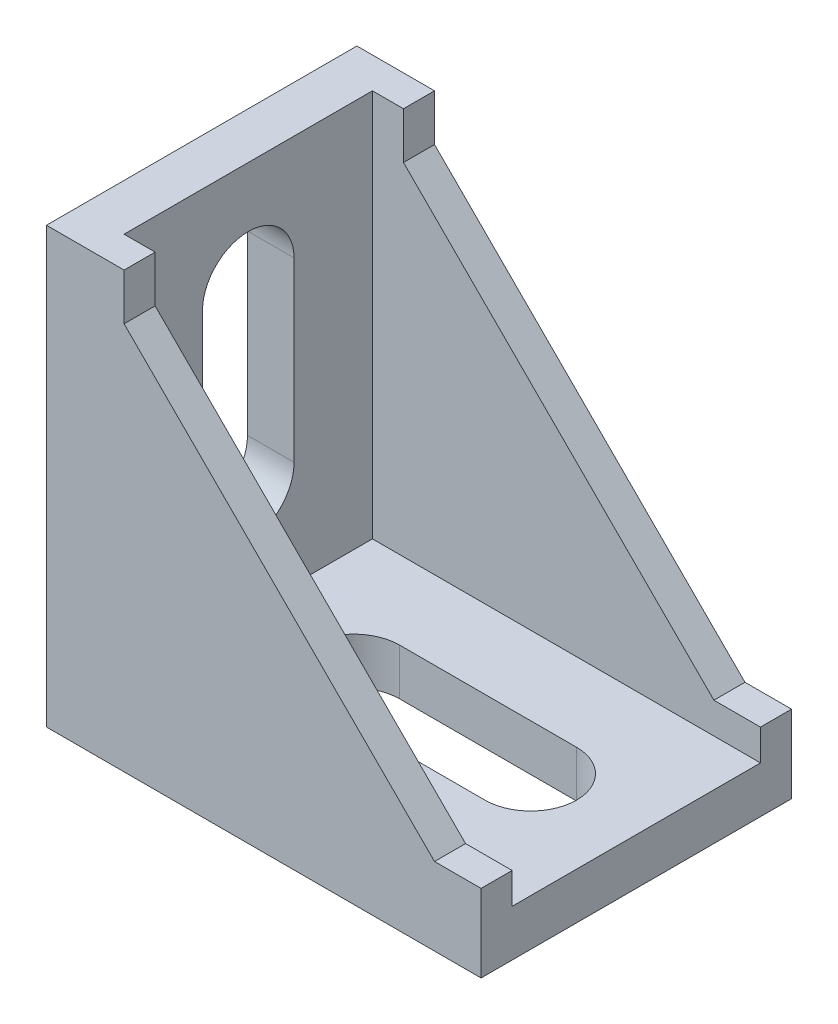
from build123d import *

# Parameters (mm, degrees)
BOSS_EXTRUDE1_DEPTH = 20
CUT_EXTRUDE1_DEPTH  = 10
CUT_EXTRUDE2_DEPTH  = 10
BOSS_EXTRUDE2_DEPTH = 2


with BuildPart() as part:
    # Sketch2 → Boss-Extrude1 (new body)
    with BuildSketch(Plane.XY):
        Polygon((0, 0), (0, 28), (3, 28), (3, 3), (28, 3), (28, 0), align=None)
    extrude(amount=-BOSS_EXTRUDE1_DEPTH)

    # Sketch4 → Cut-Extrude1 (cut)
    with BuildSketch(Plane(origin=(0, 3, 0), x_dir=(1, 0, 0), z_dir=(0, 1, 0))):
        with BuildLine():
            Line((9.8, 12.95), (21.2, 12.95))
            ThreePointArc((21.2, 12.95), (24.15, 10), (21.2, 7.05))
            Line((21.2, 7.05), (9.8, 7.05))
            ThreePointArc((9.8, 7.05), (6.85, 10), (9.8, 12.95))
        make_face()
    extrude(amount=-CUT_EXTRUDE1_DEPTH, mode=Mode.SUBTRACT)

    # Sketch5 → Cut-Extrude2 (cut)
    with BuildSketch(Plane(origin=(3, 0, 0), x_dir=(0, 0, -1), z_dir=(1, 0, 0))):
        with BuildLine():
            Line((12.95, 21.2), (12.95, 9.8))
            ThreePointArc((12.95, 9.8), (10, 6.85), (7.05, 9.8))
            Line((7.05, 9.8), (7.05, 21.2))
            ThreePointArc((7.05, 21.2), (10, 24.15), (12.95, 21.2))
        make_face()
    extrude(amount=-CUT_EXTRUDE2_DEPTH, mode=Mode.SUBTRACT)

    # Sketch6 → Boss-Extrude2 (add)
    with BuildSketch(Plane.XY):
        Polygon((3, 28), (5, 28), (5, 25), (25, 5), (28, 5), (28, 3), (3, 3), align=None)
    boss_extrude2 = extrude(amount=-BOSS_EXTRUDE2_DEPTH)

    # Mirror4: Boss-Extrude2 across plane
    add(boss_extrude2.mirror(Plane(origin=(0, 0, -10), x_dir=(1, 0, 0), z_dir=(0, 0, -1))))


solid = part.part
